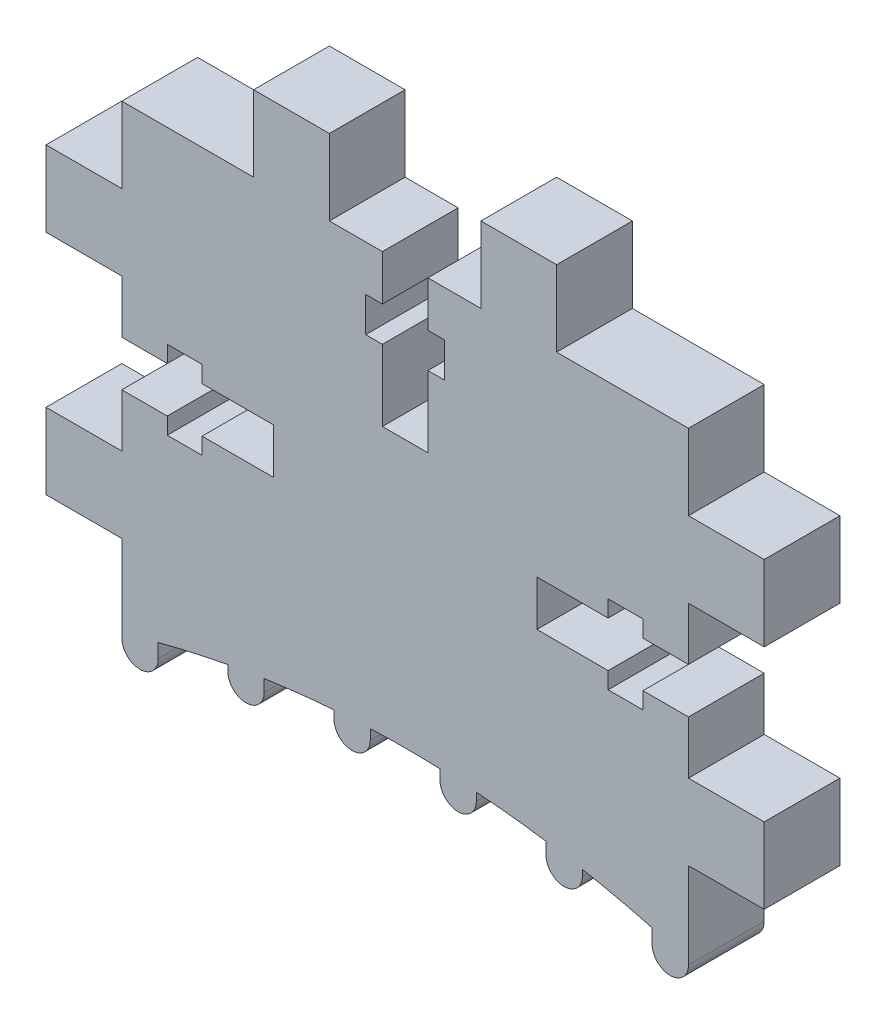
from build123d import *

# Parameters (mm, degrees)
BOSS_EXTRUDE1_DEPTH = 5


with BuildPart() as part:
    # Sketch1 → Boss-Extrude1 (new body)
    with BuildSketch(Plane.XY):
        with BuildLine():
            Line((-18.7, 12.184100059), (-18.7, 11.940969848))
            ThreePointArc((-18.7, 11.940969848), (-17.5, 10.740969848), (-16.3, 11.940969848))
            Line((-16.3, 11.940969848), (-16.3, 12.872306458))
            ThreePointArc((-16.3, 12.872306458), (-14.009663332, 13.435283428), (-11.7, 13.912819196))
            Line((-11.7, 13.912819196), (-11.7, 13.525873247))
            ThreePointArc((-11.7, 13.525873247), (-10.5, 12.325873247), (-9.3, 13.525873247))
            Line((-9.3, 13.525873247), (-9.3, 14.315284764))
            ThreePointArc((-9.3, 14.315284764), (-7.004652926, 14.612477668), (-4.7, 14.825824116))
            Line((-4.7, 14.825824116), (-4.7, 14.303469937))
            ThreePointArc((-4.7, 14.303469937), (-3.5, 13.103469937), (-2.3, 14.303469937))
            Line((-2.3, 14.303469937), (-2.3, 14.958332786))
            ThreePointArc((-2.3, 14.958332786), (0, 15), (2.3, 14.958332786))
            Line((2.3, 14.958332786), (2.3, 14.303469937))
            ThreePointArc((2.3, 14.303469937), (3.5, 13.103469937), (4.7, 14.303469937))
            Line((4.7, 14.303469937), (4.7, 14.825824116))
            ThreePointArc((4.7, 14.825824116), (7.004652926, 14.612477668), (9.3, 14.315284764))
            Line((9.3, 14.315284764), (9.3, 13.525873247))
            ThreePointArc((9.3, 13.525873247), (10.5, 12.325873247), (11.7, 13.525873247))
            Line((11.7, 13.525873247), (11.7, 13.912819196))
            ThreePointArc((11.7, 13.912819196), (14.009663332, 13.435283428), (16.3, 12.872306458))
            Line((16.3, 12.872306458), (16.3, 11.940969848))
            ThreePointArc((16.3, 11.940969848), (17.5, 10.740969848), (18.7, 11.940969848))
            Line((18.7, 11.940969848), (18.7, 12.184100059))
            Line((18.7, 12.184100059), (18.7, 17.622423299))
            Line((18.7, 17.622423299), (23.7, 17.622423299))
            Line((23.7, 17.622423299), (23.7, 22.622423299))
            Line((23.7, 22.622423299), (18.7, 22.622423299))
            Line((18.7, 22.622423299), (18.7, 26.122423299))
            Line((18.7, 26.122423299), (15.7, 26.122423299))
            Line((15.7, 26.122423299), (15.7, 25.022423299))
            Line((15.7, 25.022423299), (13.4, 25.022423299))
            Line((13.4, 25.022423299), (13.4, 26.122423299))
            Line((13.4, 26.122423299), (8.7, 26.122423299))
            Line((8.7, 26.122423299), (8.7, 29.122423299))
            Line((8.7, 29.122423299), (13.4, 29.122423299))
            Line((13.4, 29.122423299), (13.4, 30.222423299))
            Line((13.4, 30.222423299), (15.7, 30.222423299))
            Line((15.7, 30.222423299), (15.7, 29.122423299))
            Line((15.7, 29.122423299), (18.7, 29.122423299))
            Line((18.7, 29.122423299), (18.7, 32.622423299))
            Line((18.7, 32.622423299), (23.7, 32.622423299))
            Line((23.7, 32.622423299), (23.7, 37.622423299))
            Line((23.7, 37.622423299), (18.7, 37.622423299))
            Line((18.7, 37.622423299), (18.7, 42.622423299))
            Line((18.7, 42.622423299), (10, 42.622423299))
            Line((10, 42.622423299), (10, 47.622423299))
            Line((10, 47.622423299), (5, 47.622423299))
            Line((5, 47.622423299), (5, 42.622423299))
            Line((5, 42.622423299), (1.5, 42.622423299))
            Line((1.5, 42.622423299), (1.5, 39.622423299))
            Line((1.5, 39.622423299), (2.6, 39.622423299))
            Line((2.6, 39.622423299), (2.6, 37.322423299))
            Line((2.6, 37.322423299), (1.5, 37.322423299))
            Line((1.5, 37.322423299), (1.5, 32.622423299))
            Line((1.5, 32.622423299), (-1.5, 32.622423299))
            Line((-1.5, 32.622423299), (-1.5, 37.322423299))
            Line((-1.5, 37.322423299), (-2.6, 37.322423299))
            Line((-2.6, 37.322423299), (-2.6, 39.622423299))
            Line((-2.6, 39.622423299), (-1.5, 39.622423299))
            Line((-1.5, 39.622423299), (-1.5, 42.622423299))
            Line((-1.5, 42.622423299), (-5, 42.622423299))
            Line((-5, 42.622423299), (-5, 47.622423299))
            Line((-5, 47.622423299), (-10, 47.622423299))
            Line((-10, 47.622423299), (-10, 42.622423299))
            Line((-10, 42.622423299), (-18.7, 42.622423299))
            Line((-18.7, 42.622423299), (-18.7, 37.622423299))
            Line((-18.7, 37.622423299), (-23.7, 37.622423299))
            Line((-23.7, 37.622423299), (-23.7, 32.622423299))
            Line((-23.7, 32.622423299), (-18.7, 32.622423299))
            Line((-18.7, 32.622423299), (-18.7, 29.122423299))
            Line((-18.7, 29.122423299), (-15.7, 29.122423299))
            Line((-15.7, 29.122423299), (-15.7, 30.222423299))
            Line((-15.7, 30.222423299), (-13.4, 30.222423299))
            Line((-13.4, 30.222423299), (-13.4, 29.122423299))
            Line((-13.4, 29.122423299), (-8.7, 29.122423299))
            Line((-8.7, 29.122423299), (-8.7, 26.122423299))
            Line((-8.7, 26.122423299), (-13.4, 26.122423299))
            Line((-13.4, 26.122423299), (-13.4, 25.022423299))
            Line((-13.4, 25.022423299), (-15.7, 25.022423299))
            Line((-15.7, 25.022423299), (-15.7, 26.122423299))
            Line((-15.7, 26.122423299), (-18.7, 26.122423299))
            Line((-18.7, 26.122423299), (-18.7, 22.622423299))
            Line((-18.7, 22.622423299), (-23.7, 22.622423299))
            Line((-23.7, 22.622423299), (-23.7, 17.622423299))
            Line((-23.7, 17.622423299), (-18.7, 17.622423299))
            Line((-18.7, 17.622423299), (-18.7, 12.184100059))
        make_face()
    extrude(amount=BOSS_EXTRUDE1_DEPTH)


solid = part.part
